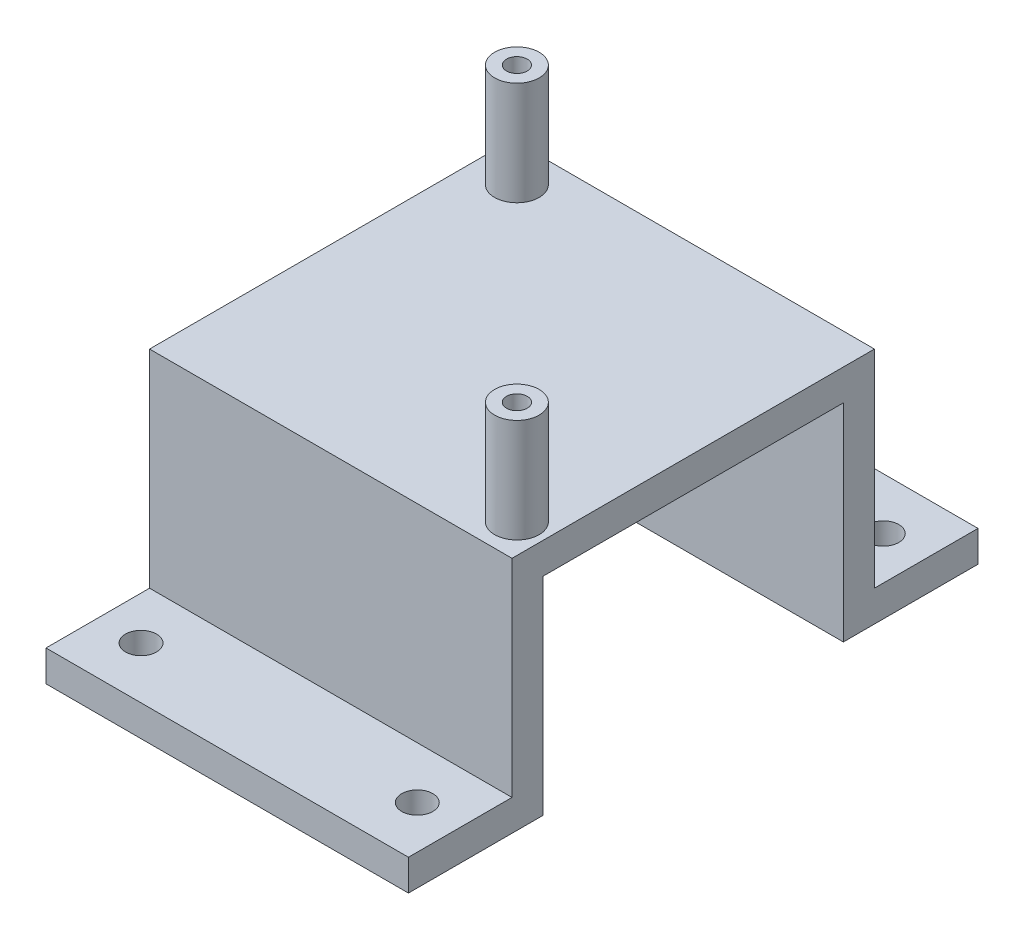
from build123d import *

# Parameters (mm, degrees)
SKETCH1_W           = 35
SKETCH1_H           = 35
BOSS_EXTRUDE1_DEPTH = 3
SKETCH2_R           = 2.15
SKETCH2_R_2         = 1
BOSS_EXTRUDE2_DEPTH = 10
SKETCH3_W           = 35
SKETCH3_H           = 3
BOSS_EXTRUDE3_DEPTH = 20
SKETCH4_W           = 35
SKETCH4_H           = 3
BOSS_EXTRUDE4_DEPTH = 10
SKETCH5_R           = 1.5
CUT_EXTRUDE1_DEPTH  = 10


with BuildPart() as part:
    # Sketch1 → Boss-Extrude1 (new body)
    with BuildSketch(Plane(origin=(0, 0, 0), x_dir=(1, 0, 0), z_dir=(0, 1, 0))):
        Rectangle(SKETCH1_W, SKETCH1_H)
    extrude(amount=BOSS_EXTRUDE1_DEPTH)

    # Sketch2 → Boss-Extrude2 (add)
    # profile 1 of 2: a face of its own
    with BuildSketch(Plane(origin=(0, 3, 0), x_dir=(1, 0, 0), z_dir=(0, 1, 0))):
        with Locations(Location((-13.512690171, 13.984805963, 0), (0, 0, 90))):
            Circle(SKETCH2_R)
        with Locations(Location((-13.512690171, 13.984805963, 0), (0, 0, 270))):
            Circle(SKETCH2_R_2, mode=Mode.SUBTRACT)
    # profile 2 of 2: a face of its own
    with BuildSketch(Plane(origin=(0, 3, 0), x_dir=(1, 0, 0), z_dir=(0, 1, 0))):
        with Locations(Location((14.687309829, -14.215194037, 0), (0, 0, 90))):
            Circle(SKETCH2_R)
        with Locations(Location((14.687309829, -14.215194037, 0), (0, 0, 270))):
            Circle(SKETCH2_R_2, mode=Mode.SUBTRACT)
    extrude(amount=BOSS_EXTRUDE2_DEPTH)

    # Sketch3 → Boss-Extrude3 (add)
    with BuildSketch(Plane.XZ):
        with Locations((0, 16)):
            Rectangle(SKETCH3_W, SKETCH3_H)
        with Locations((0, -16)):
            Rectangle(SKETCH3_W, SKETCH3_H)
    extrude(amount=BOSS_EXTRUDE3_DEPTH)

    # Sketch4 → Boss-Extrude4 (add)
    with BuildSketch(Plane(origin=(0, 0, -17.5), x_dir=(-1, 0, 0), z_dir=(0, 0, -1))):
        with Locations((0, -18.5)):
            Rectangle(SKETCH4_W, SKETCH4_H)
    boss_extrude4 = extrude(amount=BOSS_EXTRUDE4_DEPTH)

    # Sketch5 → Cut-Extrude1 (cut)
    with BuildSketch(Plane(origin=(0, -17, 0), x_dir=(1, 0, 0), z_dir=(0, 1, 0))):
        with Locations(Location((-13.324621587, 22.5, 0), (0, 0, 180))):
            Circle(SKETCH5_R)
        with Locations(Location((13.355252901, 22.5, 0), (0, 0, 180))):
            Circle(SKETCH5_R)
    cut_extrude1 = extrude(amount=-CUT_EXTRUDE1_DEPTH, mode=Mode.SUBTRACT)

    # Mirror1: Boss-Extrude4, Cut-Extrude1 across plane
    add(boss_extrude4.mirror(Plane.XY))
    add(cut_extrude1.mirror(Plane.XY), mode=Mode.SUBTRACT)


solid = part.part
